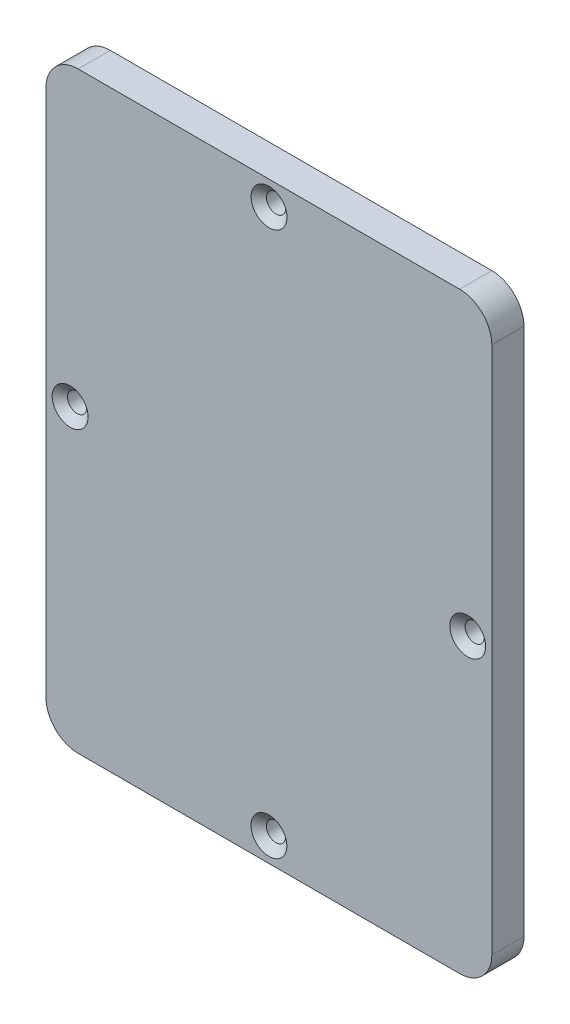
from build123d import *

# Parameters (mm, degrees)
SKETCH1_R                                         = 1.5875
BOSS_EXTRUDE1_DEPTH                               = 6.35
CSK_FOR_6_FLAT_HEAD_MACHINE_SCREW_100_D           = 3.7973
CSK_FOR_6_FLAT_HEAD_MACHINE_SCREW_100_CSINK_D     = 7.0866
CSK_FOR_6_FLAT_HEAD_MACHINE_SCREW_100_CSINK_ANGLE = 100


with BuildPart() as part:
    # Sketch1 → Boss-Extrude1 (new body)
    with BuildSketch(Plane.XY):
        with BuildLine():
            Line((0, 0), (75.3, 0))
            ThreePointArc((75.3, 0), (79.790128061, 1.859871939), (81.65, 6.35))
            Line((81.65, 6.35), (81.65, 110.65))
            ThreePointArc((81.65, 110.65), (79.790128061, 115.140128061), (75.3, 117))
            Line((75.3, 117), (0, 117))
            ThreePointArc((0, 117), (-4.490128061, 115.140128061), (-6.35, 110.65))
            Line((-6.35, 110.65), (-6.35, 6.35))
            ThreePointArc((-6.35, 6.35), (-4.490128061, 1.859871939), (0, 0))
        make_face()
        with Locations((37.65, 4.7625)):
            Circle(SKETCH1_R, mode=Mode.SUBTRACT)
        with Locations((76.8875, 58.5)):
            Circle(SKETCH1_R, mode=Mode.SUBTRACT)
        with Locations((37.673789808, 112.2375)):
            Circle(SKETCH1_R, mode=Mode.SUBTRACT)
        with Locations((-1.5875, 58.5)):
            Circle(SKETCH1_R, mode=Mode.SUBTRACT)
    extrude(amount=BOSS_EXTRUDE1_DEPTH)

    # CSK for #6 Flat Head Machine Screw (100)1 (through all)
    with Locations(Plane.XY.offset(6.35)):
        with Locations((-1.5875, 58.5), (37.673789808, 112.2375), (76.8875, 58.5), (37.65, 4.7625)):
            CounterSinkHole(CSK_FOR_6_FLAT_HEAD_MACHINE_SCREW_100_D / 2, CSK_FOR_6_FLAT_HEAD_MACHINE_SCREW_100_CSINK_D / 2, counter_sink_angle=CSK_FOR_6_FLAT_HEAD_MACHINE_SCREW_100_CSINK_ANGLE)


solid = part.part
